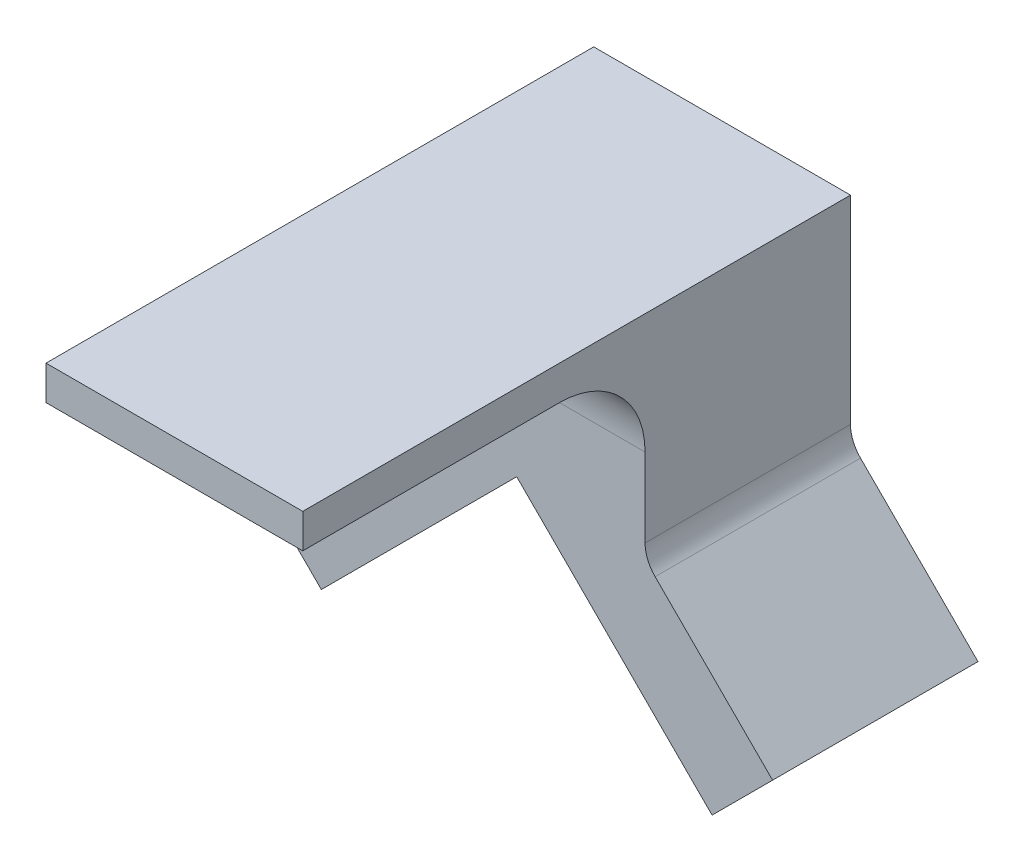
from build123d import *

# Parameters (mm, degrees)
BOSS_EXTRU_1_DEPTH = 12
ESQUISSE3_W        = 15
ESQUISSE3_H        = 32
BOSS_EXTRU_2_DEPTH = 2
CONG_2_R           = 2
CONG_3_R           = 5


with BuildPart() as part:
    # Esquisse2 → Boss.-Extru.1 (new body)
    with BuildSketch(Plane.XY):
        Polygon((-2.5, -20), (0, -17.5), (0, -10.428932188), (-6.035533906, -16.464466094), align=None)
        Polygon((7.5, -10), (7.5, 0), (0, 0), (0, -10.428932188), (0, -17.5), align=None)
        Polygon((15, 0), (7.5, 0), (7.5, -10), (15, -17.5), (15, -10.428932188), align=None)
        Polygon((15, -10.428932188), (15, -17.5), (17.5, -20), (21.035533906, -16.464466094), align=None)
        Polygon((-3.914213562, -21.414213562), (-7.449747468, -17.878679656), (-6.035533906, -16.464466094), (-2.5, -20), align=None)
        Polygon((17.5, -20), (18.914213562, -21.414213562), (22.449747468, -17.878679656), (21.035533906, -16.464466094), align=None)
    extrude(amount=BOSS_EXTRU_1_DEPTH)

    # Esquisse3 → Boss.-Extru.2 (add)
    with BuildSketch(Plane(origin=(0, 0, 0), x_dir=(1, 0, 0), z_dir=(0, 1, 0))):
        with Locations((7.5, -16)):
            Rectangle(ESQUISSE3_W, ESQUISSE3_H)
    extrude(amount=BOSS_EXTRU_2_DEPTH)

    # Congé2
    cong_2_edges = [part.edges().sort_by_distance(p)[0] for p in [
        (0, -10.428932188, 6),
        (15, -10.428932188, 6),
    ]]
    fillet(cong_2_edges, radius=CONG_2_R)

    # Congé3
    cong_3_edges = [part.edges().sort_by_distance(p)[0] for p in [
        (7.5, 0, 12),
    ]]
    fillet(cong_3_edges, radius=CONG_3_R)


solid = part.part
